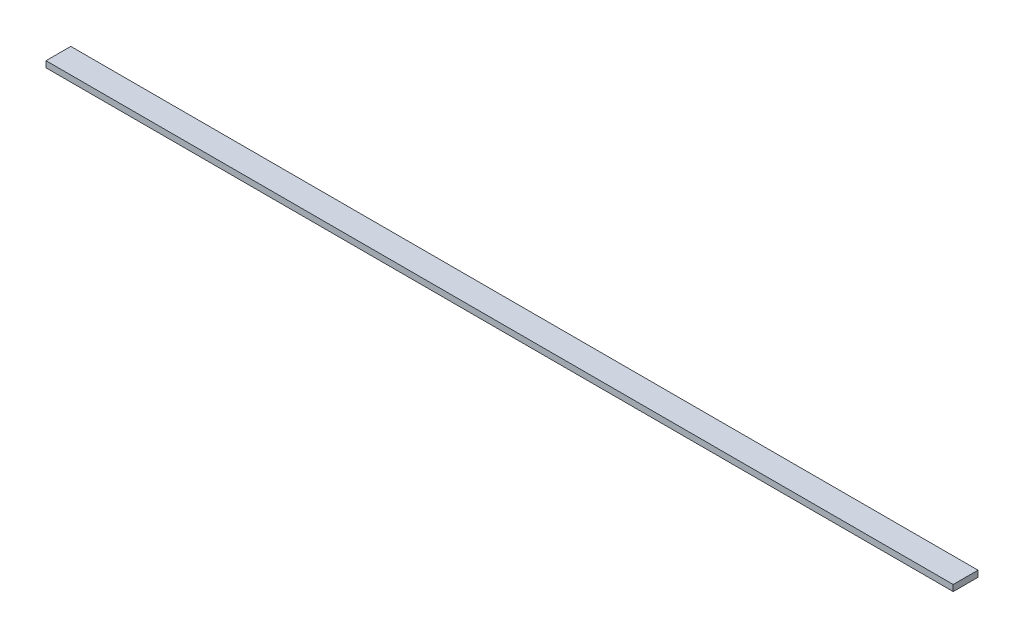
from build123d import *

# Parameters (mm, degrees)
SKETCH1_W               = 930
SKETCH1_H               = 555
SKETCH1_W_2             = 777.6
SKETCH1_H_2             = 504.2
BOSS_EXTRUDE2_DEPTH     = 6.35
CUT_EXTRUDE1_DEPTH      = 542.54554056
CUT_EXTRUDE1_DEPTH_BACK = 542.54554056
SKETCH2_W               = 930
SKETCH2_H               = 529.6


with BuildPart() as part:
    # Sketch1 → Boss-Extrude2 (new body)
    with BuildSketch(Plane(origin=(0, 0, 0), x_dir=(1, 0, 0), z_dir=(0, 1, 0))):
        Rectangle(SKETCH1_W, SKETCH1_H)
        Rectangle(SKETCH1_W_2, SKETCH1_H_2, mode=Mode.SUBTRACT)
    extrude(amount=BOSS_EXTRUDE2_DEPTH)

    # Sketch2 → Cut-Extrude1 (cut, two sides: drawn at the far end of the back side and taken through both)
    with BuildSketch(Plane(origin=(0, 6.35, 0), x_dir=(1, 0, 0), z_dir=(0, 1, 0)).offset(-CUT_EXTRUDE1_DEPTH_BACK)):
        with Locations((0, -12.7)):
            Rectangle(SKETCH2_W, SKETCH2_H)
    extrude(amount=CUT_EXTRUDE1_DEPTH + CUT_EXTRUDE1_DEPTH_BACK, mode=Mode.SUBTRACT)


solid = part.part
